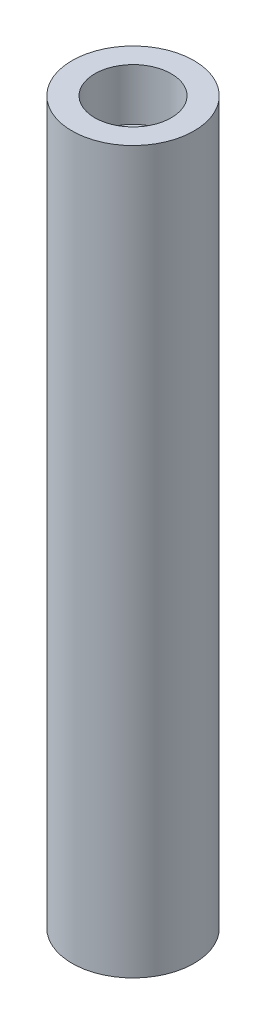
from build123d import *

# Parameters (mm, degrees)
SKETCH1_R           = 4.95
BOSS_EXTRUDE1_DEPTH = 58.5
SKETCH2_R           = 3.1
CUT_EXTRUDE1_DEPTH  = 4.2


with BuildPart() as part:
    # Sketch1 → Boss-Extrude1 (new body)
    with BuildSketch(Plane(origin=(0, 0, 0), x_dir=(1, 0, 0), z_dir=(0, 1, 0))):
        with Locations(Location((0, 0, 0), (0, 0, 90))):
            Circle(SKETCH1_R)
    extrude(amount=BOSS_EXTRUDE1_DEPTH)

    # Sketch2 → Cut-Extrude1 (cut)
    with BuildSketch(Plane(origin=(0, 58.5, 0), x_dir=(1, 0, 0), z_dir=(0, 1, 0))):
        with Locations(Location((0, 0, 0), (0, 0, 270))):
            Circle(SKETCH2_R)
    extrude(amount=-CUT_EXTRUDE1_DEPTH, mode=Mode.SUBTRACT)


solid = part.part
